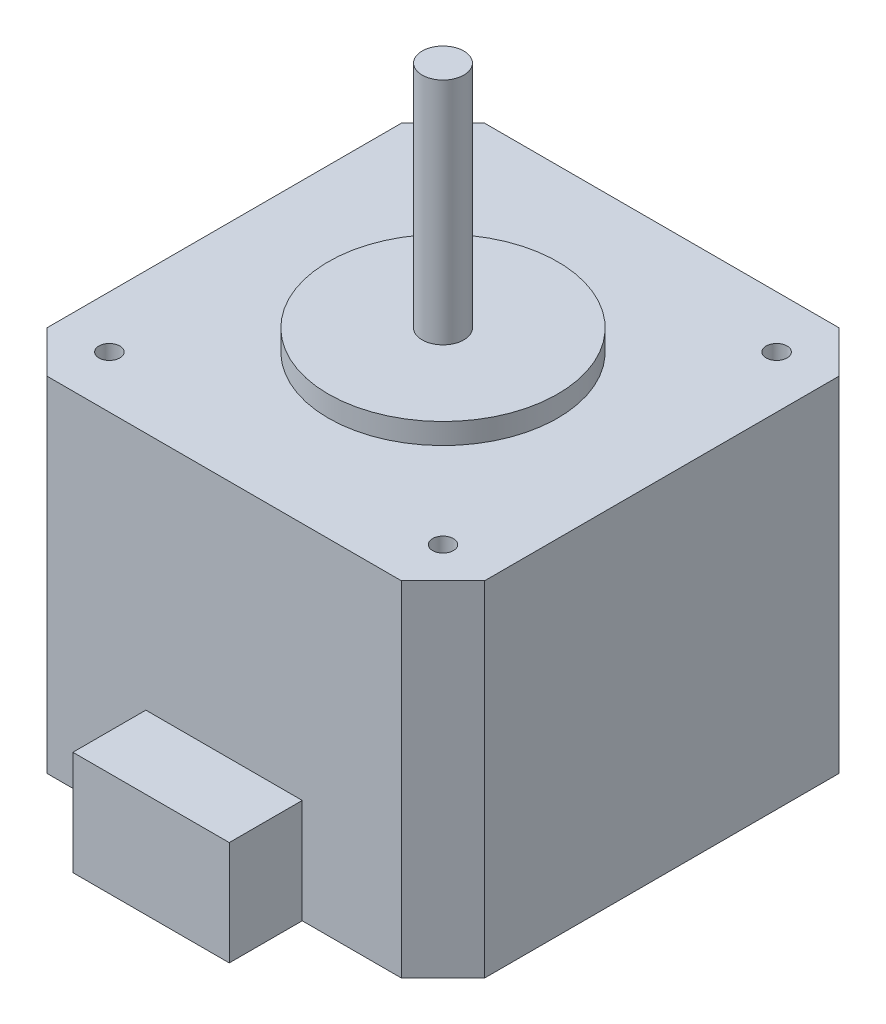
from build123d import *

# Parameters (mm, degrees)
SKETCH1_W                           = 42
SKETCH1_H                           = 42
BOSS_EXTRUDE1_DEPTH                 = 33
SKETCH2_R                           = 11
BOSS_EXTRUDE2_DEPTH                 = 2
SKETCH3_R                           = 2
BOSS_EXTRUDE3_DEPTH                 = 22
SKETCH4_W                           = 15
SKETCH4_H                           = 10
BOSS_EXTRUDE4_DEPTH                 = 7
F_2_0MM_CLEARANCE_DOWEL_HOLE1_D     = 2
F_2_0MM_CLEARANCE_DOWEL_HOLE1_DEPTH = 8
F_2_0MM_CLEARANCE_DOWEL_HOLE1_TIP   = 0.600860619
CHAMFER1_SIZE                       = 4


with BuildPart() as part:
    # Sketch1 → Boss-Extrude1 (new body)
    with BuildSketch(Plane(origin=(0, 0, 0), x_dir=(1, 0, 0), z_dir=(0, 1, 0))):
        with Locations((21, -21)):
            Rectangle(SKETCH1_W, SKETCH1_H)
    extrude(amount=BOSS_EXTRUDE1_DEPTH)

    # Sketch2 → Boss-Extrude2 (add)
    with BuildSketch(Plane(origin=(0, 33, 0), x_dir=(1, 0, 0), z_dir=(0, 1, 0))):
        with Locations(Location((21, -21, 0), (0, 0, 270))):
            Circle(SKETCH2_R)
    extrude(amount=BOSS_EXTRUDE2_DEPTH)

    # Sketch3 → Boss-Extrude3 (add)
    with BuildSketch(Plane(origin=(0, 35, 0), x_dir=(1, 0, 0), z_dir=(0, 1, 0))):
        with Locations(Location((21, -21, 0), (0, 0, 270))):
            Circle(SKETCH3_R)
    extrude(amount=BOSS_EXTRUDE3_DEPTH)

    # Sketch4 → Boss-Extrude4 (add)
    with BuildSketch(Plane.XY.offset(42)):
        with Locations((21, 5)):
            Rectangle(SKETCH4_W, SKETCH4_H)
    extrude(amount=BOSS_EXTRUDE4_DEPTH)

    # Ø2.0mm Clearance Dowel Hole1
    with Locations(Plane(origin=(37, 33, 5), x_dir=(0, 0, 1), z_dir=(0, 1, 0))):
        with Locations((0, 0), (32, 0), (32, -32), (0, -32)):
            Hole(F_2_0MM_CLEARANCE_DOWEL_HOLE1_D / 2, depth=F_2_0MM_CLEARANCE_DOWEL_HOLE1_DEPTH)
            with Locations((0, 0, -(F_2_0MM_CLEARANCE_DOWEL_HOLE1_DEPTH + F_2_0MM_CLEARANCE_DOWEL_HOLE1_TIP / 2))):  # 118° drill point
                Cone(0, F_2_0MM_CLEARANCE_DOWEL_HOLE1_D / 2, F_2_0MM_CLEARANCE_DOWEL_HOLE1_TIP, mode=Mode.SUBTRACT)

    # Chamfer1
    chamfer1_edges = [part.edges().sort_by_distance(p)[0] for p in [
        (0, 16.5, 0),
        (42, 16.5, 0),
        (42, 16.5, 42),
        (0, 16.5, 42),
    ]]
    chamfer(chamfer1_edges, length=CHAMFER1_SIZE)


solid = part.part
